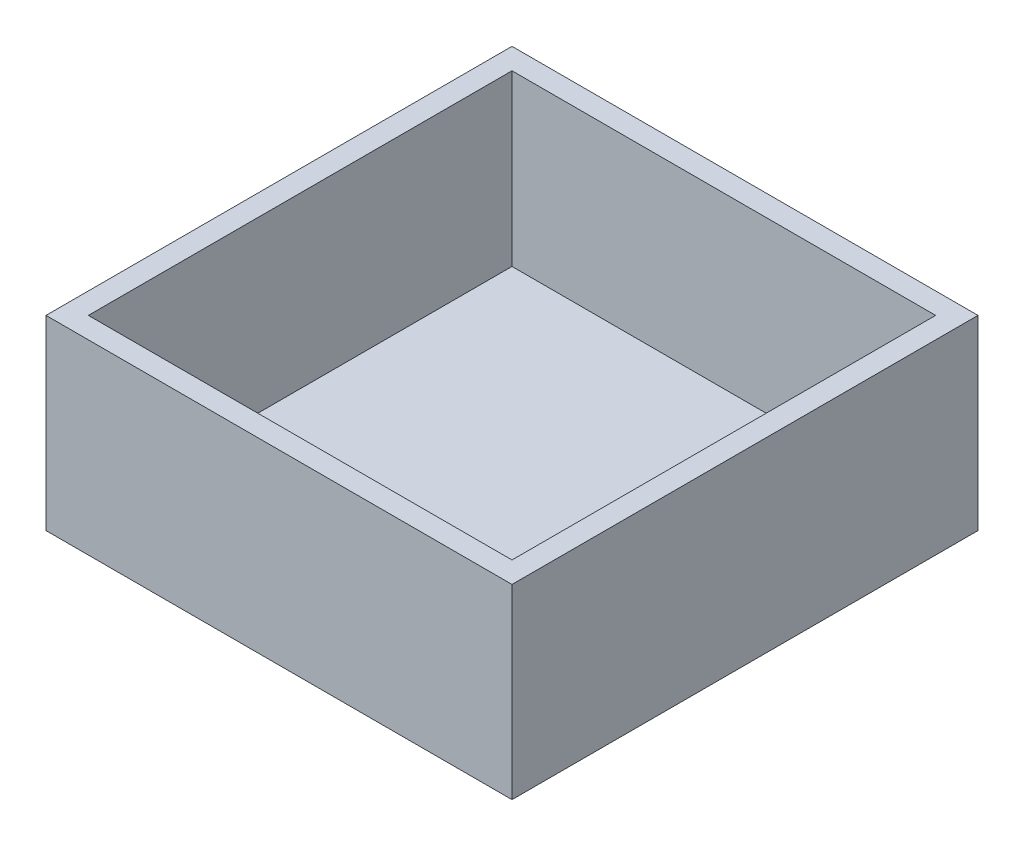
from build123d import *

# Parameters (mm, degrees)
SKETCH_1_W      = 110
SKETCH_1_H      = 110
SKETCH_1_W_2    = 100
SKETCH_1_H_2    = 100
EXTRUDE_1_DEPTH = 40
SKETCH_2_W      = 110
SKETCH_2_H      = 110
EXTRUDE_2_DEPTH = 4


with BuildPart() as part:
    # 草图1 → 凸台-拉伸1 (new body)
    with BuildSketch(Plane(origin=(0, 0, 0), x_dir=(1, 0, 0), z_dir=(0, 1, 0))):
        with Locations((50, -50)):
            Rectangle(SKETCH_1_W, SKETCH_1_H)
        with Locations((50, -50)):
            Rectangle(SKETCH_1_W_2, SKETCH_1_H_2, mode=Mode.SUBTRACT)
    extrude(amount=EXTRUDE_1_DEPTH)

    # 草图2 → 凸台-拉伸2 (add)
    with BuildSketch(Plane.XZ):
        with Locations((50, 50)):
            Rectangle(SKETCH_2_W, SKETCH_2_H)
    extrude(amount=EXTRUDE_2_DEPTH)


solid = part.part
